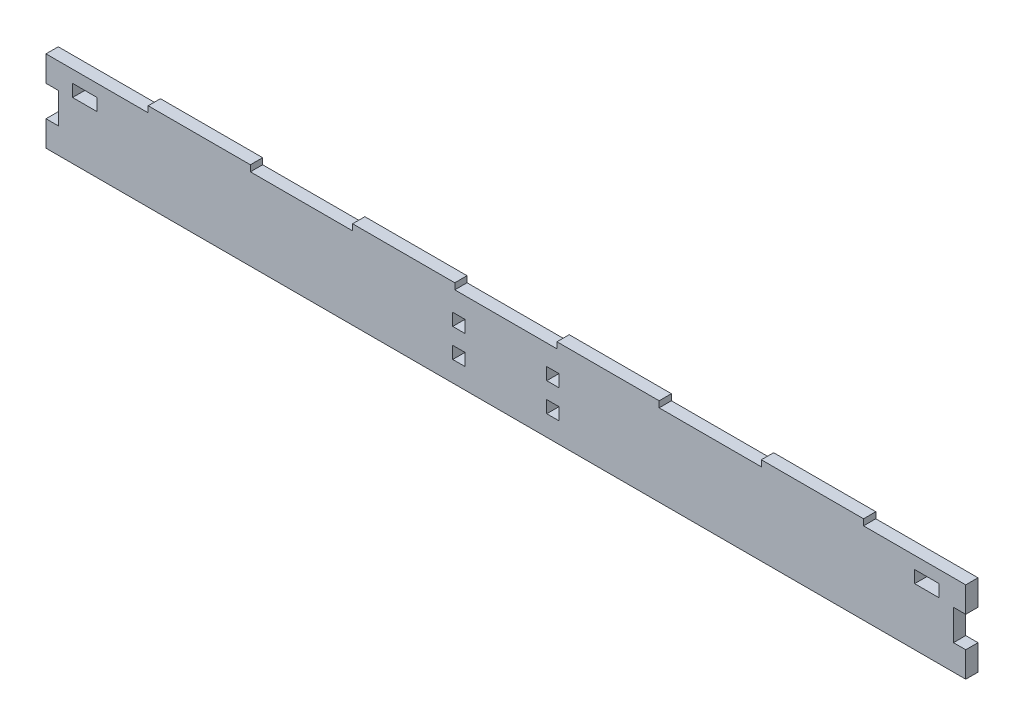
from build123d import *

# Parameters (mm, degrees)
SKETCH_1_W      = 12
SKETCH_1_H      = 6
SKETCH_1_W_2    = 6
EXTRUDE_1_DEPTH = 6


with BuildPart() as part:
    # Эскиз1 → Бобышка-Вытянуть1 (new body)
    with BuildSketch(Plane.XY):
        Polygon((100, 40), (150, 40), (150, 43), (200, 43), (200, 40), (250, 40), (250, 43), (300, 43), (300, 40), (350, 40), (350, 43), (400, 43), (400, 40), (450, 40), (450, 27.5), (444, 27.5), (444, 12.5), (450, 12.5), (450, 0), (0, 0), (0, 12.5), (6, 12.5), (6, 27.5), (0, 27.5), (0, 40), (50, 40), (50, 43), (100, 43), align=None)
        with Locations((19, 31)):
            Rectangle(SKETCH_1_W, SKETCH_1_H, mode=Mode.SUBTRACT)
        with Locations((431, 31)):
            Rectangle(SKETCH_1_W, SKETCH_1_H, mode=Mode.SUBTRACT)
        with Locations((248, 27)):
            Rectangle(SKETCH_1_W_2, SKETCH_1_H, mode=Mode.SUBTRACT)
        with Locations((248, 13)):
            Rectangle(SKETCH_1_W_2, SKETCH_1_H, mode=Mode.SUBTRACT)
        with Locations((202, 27)):
            Rectangle(SKETCH_1_W_2, SKETCH_1_H, mode=Mode.SUBTRACT)
        with Locations((202, 13)):
            Rectangle(SKETCH_1_W_2, SKETCH_1_H, mode=Mode.SUBTRACT)
    extrude(amount=EXTRUDE_1_DEPTH)


solid = part.part
